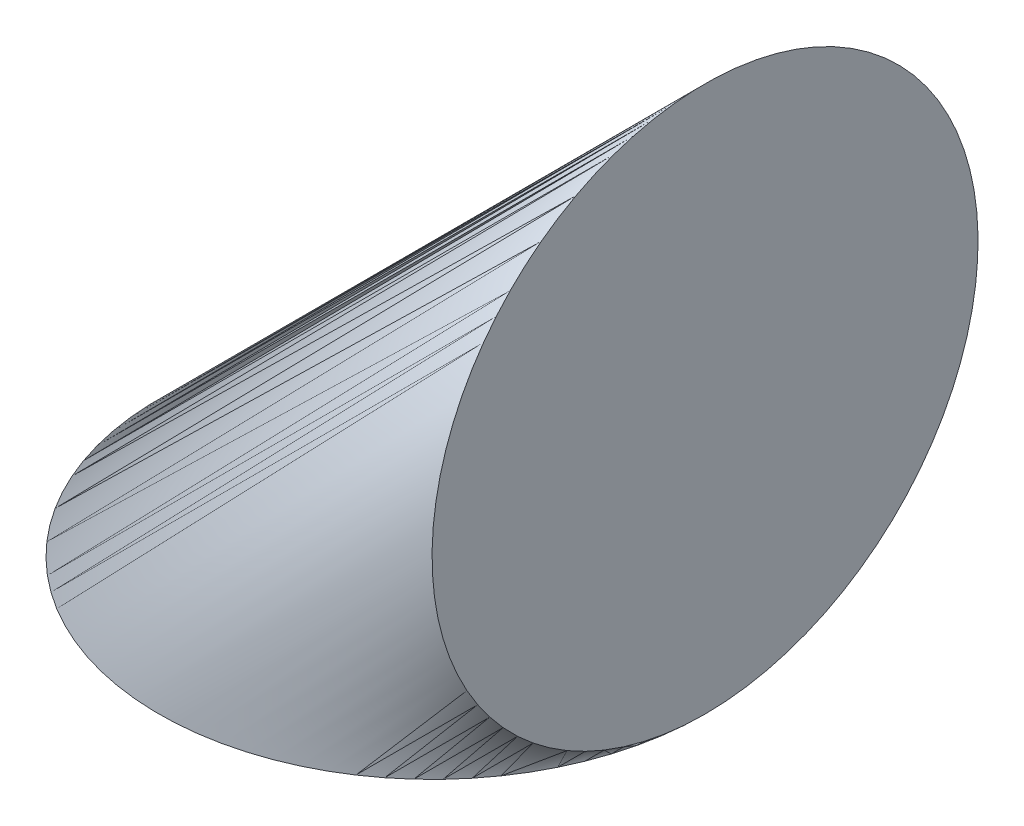
from build123d import *

# Parameters (mm, degrees)
SKETCH2_R = 50


with BuildPart() as part:
    # Sweep1: sweep along a path in Sketch4
    with BuildLine(Plane.XY) as sweep1_path:
        ThreePointArc((0, 0), (14.644660941, 35.355339059), (50, 50))
    # Sketch2 → Sweep1 (sweep)
    with BuildSketch(Plane(origin=(0, 0, 0), x_dir=(1, 0, 0), z_dir=(0, 1, 0))):
        Circle(SKETCH2_R)
    sweep(path=sweep1_path.line)


solid = part.part
